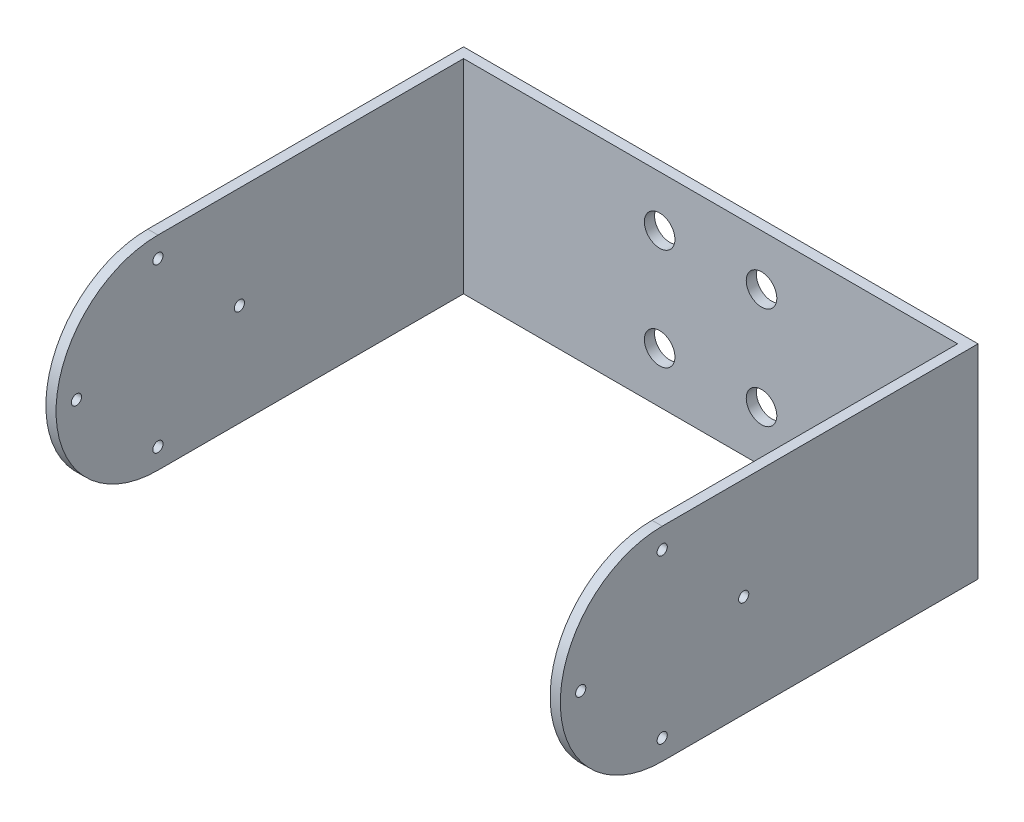
from build123d import *

# Parameters (mm, degrees)
SKETCH_1_W          = 50.5
SKETCH_1_H          = 20
EXTRUDE_1_DEPTH     = 1
SKETCH_2_W          = 1
SKETCH_2_H          = 20
EXTRUDE_2_DEPTH     = 40
CUT_EXTRUDE_2_DEPTH = 100
SKETCH_4_R          = 0.5
CUT_EXTRUDE_3_DEPTH = 66.812232905
CUT_EXTRUDE_4_REACH = 51.179
SKETCH_5_R          = 1.5


with BuildPart() as part:
    # 草图1 → 凸台-拉伸1 (new body)
    with BuildSketch(Plane.XY):
        Rectangle(SKETCH_1_W, SKETCH_1_H)
    extrude(amount=EXTRUDE_1_DEPTH)

    # 草图2 → 凸台-拉伸2 (add)
    with BuildSketch(Plane.XY.offset(1)):
        with Locations((-24.75, 0)):
            Rectangle(SKETCH_2_W, SKETCH_2_H)
        with Locations((24.75, 0)):
            Rectangle(SKETCH_2_W, SKETCH_2_H)
    extrude(amount=EXTRUDE_2_DEPTH)

    # 草图3 → 切除-拉伸2 (cut)
    with BuildSketch(Plane.ZY.offset(25.25)):
        with BuildLine():
            Line((31, -10), (41, -10))
            Line((41, -10), (41, 0))
            ThreePointArc((41, 0), (38.071067812, -7.071067812), (31, -10))
        make_face()
        with BuildLine():
            ThreePointArc((31, 10), (38.071067812, 7.071067812), (41, 0))
            Line((41, 0), (41, 10))
            Line((41, 10), (31, 10))
        make_face()
    extrude(amount=-CUT_EXTRUDE_2_DEPTH, mode=Mode.SUBTRACT)

    # 草图4 → 切除-拉伸3 (cut, through all)
    with BuildSketch(Plane(origin=(25.25, 0, 0), x_dir=(0, 0, -1), z_dir=(1, 0, 0))):
        with Locations((-39, 0)):
            Circle(SKETCH_4_R)
        with Locations((-31, 8)):
            Circle(SKETCH_4_R)
        with Locations((-23, 0)):
            Circle(SKETCH_4_R)
        with Locations((-31, -8)):
            Circle(SKETCH_4_R)
    extrude(amount=-CUT_EXTRUDE_3_DEPTH, mode=Mode.SUBTRACT)

    # 草图5 → 切除-拉伸4 (cut, up to next)
    with BuildSketch(Plane(origin=(0, 0, 0), x_dir=(-1, 0, 0), z_dir=(0, 0, -1)), mode=Mode.PRIVATE) as cut_extrude_4_sk1:
        with Locations((-5, 5)):
            Circle(SKETCH_5_R)
    cut_extrude_4_tool1 = extrude(cut_extrude_4_sk1.sketch, amount=-CUT_EXTRUDE_4_REACH, mode=Mode.PRIVATE) & part.part
    # 草图5 → 切除-拉伸4 (cut, up to next)
    with BuildSketch(Plane(origin=(0, 0, 0), x_dir=(-1, 0, 0), z_dir=(0, 0, -1)), mode=Mode.PRIVATE) as cut_extrude_4_sk2:
        with Locations((-5, -5)):
            Circle(SKETCH_5_R)
    cut_extrude_4_tool2 = extrude(cut_extrude_4_sk2.sketch, amount=-CUT_EXTRUDE_4_REACH, mode=Mode.PRIVATE) & part.part
    # 草图5 → 切除-拉伸4 (cut, up to next)
    with BuildSketch(Plane(origin=(0, 0, 0), x_dir=(-1, 0, 0), z_dir=(0, 0, -1)), mode=Mode.PRIVATE) as cut_extrude_4_sk3:
        with Locations((5, 5)):
            Circle(SKETCH_5_R)
    cut_extrude_4_tool3 = extrude(cut_extrude_4_sk3.sketch, amount=-CUT_EXTRUDE_4_REACH, mode=Mode.PRIVATE) & part.part
    # 草图5 → 切除-拉伸4 (cut, up to next)
    with BuildSketch(Plane(origin=(0, 0, 0), x_dir=(-1, 0, 0), z_dir=(0, 0, -1)), mode=Mode.PRIVATE) as cut_extrude_4_sk4:
        with Locations((5, -5)):
            Circle(SKETCH_5_R)
    cut_extrude_4_tool4 = extrude(cut_extrude_4_sk4.sketch, amount=-CUT_EXTRUDE_4_REACH, mode=Mode.PRIVATE) & part.part
    add(cut_extrude_4_tool1.solids().sort_by_distance((5, 5, 0))[0], mode=Mode.SUBTRACT)
    add(cut_extrude_4_tool2.solids().sort_by_distance((5, -5, 0))[0], mode=Mode.SUBTRACT)
    add(cut_extrude_4_tool3.solids().sort_by_distance((-5, 5, 0))[0], mode=Mode.SUBTRACT)
    add(cut_extrude_4_tool4.solids().sort_by_distance((-5, -5, 0))[0], mode=Mode.SUBTRACT)


solid = part.part
